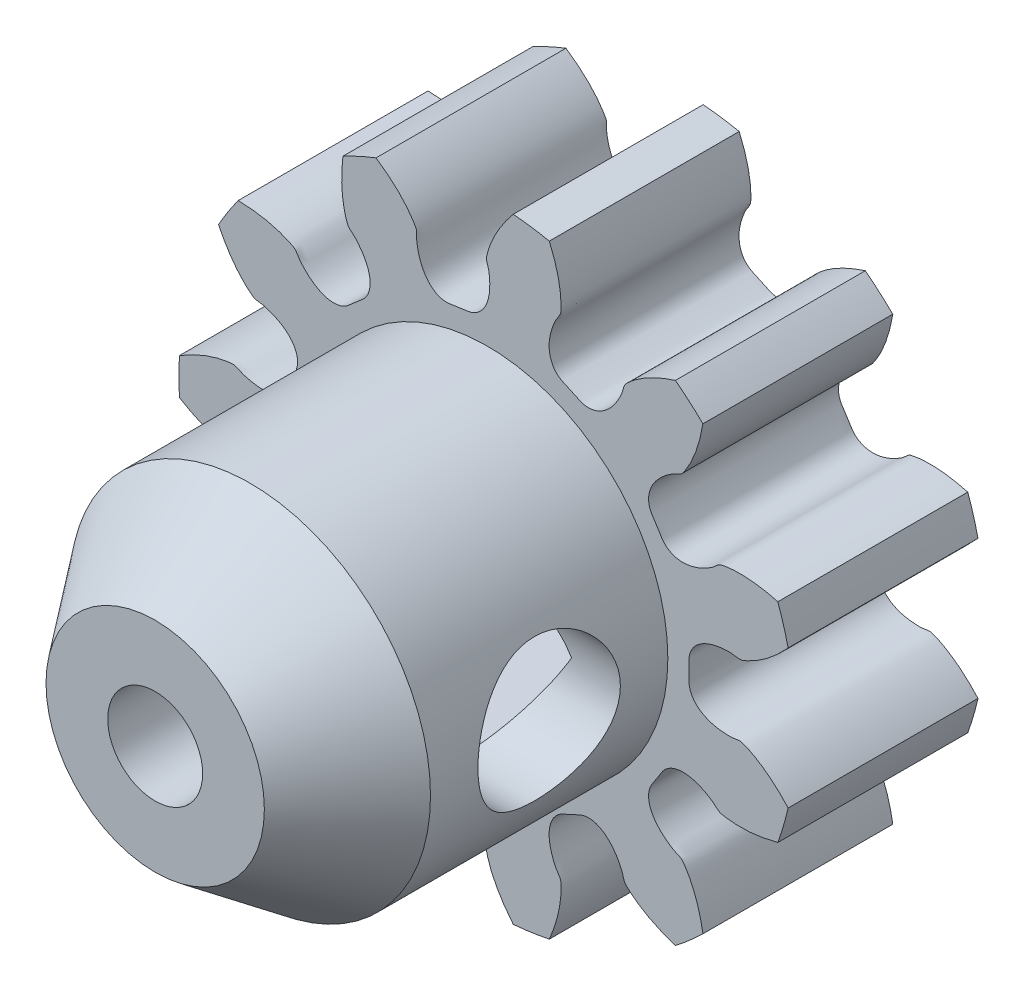
from build123d import *

# Parameters (mm, degrees)
SKETCHREVOLVESPURPINION_W       = 4
SKETCHREVOLVESPURPINION_H       = 6.499999902
TOOTHEXTRUDECUTSPURPINION_DEPTH = 2
PATTERNSPURPINION_COUNT         = 11
SKETCH1_R                       = 3.8
BOSS_EXTRUDE1_DEPTH             = 7
CHAMFER1_SIZE                   = 2
CHAMFER1_SIZE2                  = 1.5
CUT_EXTRUDE1_DEPTH              = 9
SKETCH3_R                       = 1.5
CUT_EXTRUDE2_DEPTH              = 9
SKETCH5_R                       = 1
CUT_EXTRUDE3_DEPTH              = 2


with BuildPart() as part:
    # SketchRevolveSpurPinion → SpurPinion (revolve)
    with BuildSketch(Plane(origin=(0, 0, 0), x_dir=(0, 0, -1), z_dir=(1, 0, 0))):
        with Locations((0, 3.249999951)):
            Rectangle(SKETCHREVOLVESPURPINION_W, SKETCHREVOLVESPURPINION_H)
    revolve(axis=Axis((0, 0, 0), (0, 0, -1)))

    # SketchToothSpurPinion → ToothExtrudeCutSpurPinion (cut, symmetric)
    with BuildSketch(Plane.XY):
        with BuildLine():
            ThreePointArc((6.374543401, 1.50588683), (6.549999902, 0), (6.374543401, -1.50588683))
            add(Edge.make_bspline(
                [(6.374543401, -1.50588683), (6.317672592, -1.440685446), (6.231374812, -1.348255131), (6.113043837, -1.234757319), (6.028951604, -1.159688541), (5.947483708, -1.092040478), (5.869056997, -1.031523084), (5.79407066, -0.977827594), (5.722905716, -0.93062095), (5.655922798, -0.889568861), (5.593465843, -0.854263834), (5.535846697, -0.824463365), (5.483391294, -0.799330467), (5.423302933, -0.774455108), (5.312989732, -0.72332903), (5.190756968, -0.768768581), (5.083537535, -0.766625697), (5.031278683, -0.765731508), (4.980355391, -0.762726596), (4.930720075, -0.758230258), (4.882394127, -0.752105315), (4.835376707, -0.744402623), (4.789668488, -0.735114972), (4.745265892, -0.72423865), (4.702163328, -0.711754934), (4.660353893, -0.697631874), (4.619831262, -0.681820332), (4.580592412, -0.664251063), (4.542641754, -0.644831241), (4.505997137, -0.623441187), (4.470698362, -0.599931803), (4.436818864, -0.574123801), (4.40448105, -0.545810434), (4.373875217, -0.514766276), (4.345280992, -0.480765342), (4.319086915, -0.443612262), (4.295805064, -0.403188624), (4.276057014, -0.359514565), (4.260572718, -0.312811576), (4.249988906, -0.263569949), (4.245757139, -0.218013555), (4.244894976, -0.129994862), (4.252789903, 0), (4.244894976, 0.129994862), (4.245757139, 0.218013555), (4.249988906, 0.263569949), (4.260572718, 0.312811576), (4.276057014, 0.359514565), (4.295805064, 0.403188624), (4.319086915, 0.443612262), (4.345280992, 0.480765342), (4.373875217, 0.514766276), (4.40448105, 0.545810434), (4.436818864, 0.574123801), (4.470698362, 0.599931803), (4.505997137, 0.623441187), (4.542641754, 0.644831241), (4.580592412, 0.664251063), (4.619831262, 0.681820332), (4.660353893, 0.697631874), (4.702163328, 0.711754934), (4.745265892, 0.72423865), (4.789668488, 0.735114972), (4.835376707, 0.744402623), (4.882394127, 0.752105315), (4.930720075, 0.758230258), (4.980355391, 0.762726596), (5.031278683, 0.765731508), (5.083537535, 0.766625697), (5.190756968, 0.768768581), (5.312989732, 0.72332903), (5.423302933, 0.774455108), (5.483391294, 0.799330467), (5.535846697, 0.824463365), (5.593465843, 0.854263834), (5.655922798, 0.889568861), (5.722905716, 0.93062095), (5.79407066, 0.977827594), (5.869056997, 1.031523084), (5.947483708, 1.092040478), (6.028951604, 1.159688541), (6.113043837, 1.234757319), (6.231374812, 1.348255131), (6.317672592, 1.440685446), (6.374543401, 1.50588683)],
                knots=[0, 0, 0, 0, 0.045120544, 0.065899742, 0.085491558, 0.103895991, 0.121113041, 0.137142708, 0.151984992, 0.165639894, 0.178107413, 0.18938755, 0.199480304, 0.208385675, 0.223470835, 0.261153511, 0.270450436, 0.279527598, 0.288391902, 0.297051141, 0.305514137, 0.3137909, 0.321892807, 0.329832817, 0.337625703, 0.345288317, 0.352839878, 0.360302265, 0.367700302, 0.375061988, 0.382418614, 0.389804656, 0.397257316, 0.40481549, 0.412517957, 0.420400547, 0.42849219, 0.43681006, 0.445354483, 0.454104962, 0.463018988, 0.469161013, 0.5, 0.530838987, 0.536981012, 0.545895038, 0.554645517, 0.56318994, 0.57150781, 0.579599453, 0.587482043, 0.59518451, 0.602742684, 0.610195344, 0.617581386, 0.624938012, 0.632299698, 0.639697735, 0.647160122, 0.654711683, 0.662374297, 0.670167183, 0.678107193, 0.6862091, 0.694485863, 0.702948859, 0.711608098, 0.720472402, 0.729549564, 0.738846489, 0.776529165, 0.791614325, 0.800519696, 0.81061245, 0.821892587, 0.834360106, 0.848015008, 0.862857292, 0.878886959, 0.896104009, 0.914508442, 0.934100258, 0.954879456, 1, 1, 1, 1], degree=3))
        make_face()
    toothextrudecutspurpinion = extrude(amount=TOOTHEXTRUDECUTSPURPINION_DEPTH, both=True, mode=Mode.SUBTRACT)

    # PatternSpurPinion: ToothExtrudeCutSpurPinion ×11 about axis
    patternspurpinion_axis = Axis((0, 0, 55), (0, 0, -1))
    for i in range(1, PATTERNSPURPINION_COUNT):
        add(toothextrudecutspurpinion.rotate(patternspurpinion_axis, i * 360 / PATTERNSPURPINION_COUNT), mode=Mode.SUBTRACT)

    # Sketch1 → Boss-Extrude1 (add)
    with BuildSketch(Plane.XY.offset(2)):
        Circle(SKETCH1_R)
    extrude(amount=BOSS_EXTRUDE1_DEPTH)

    # Chamfer1
    chamfer1_edges = [part.edges().sort_by_distance(p)[0] for p in [
        (-3.8, 0, 9),
    ]]
    chamfer1_side = [part.faces().sort_by_distance(p)[0] for p in [
        (-3.8, 0, 5.5),
    ]]
    chamfer(chamfer1_edges, length=CHAMFER1_SIZE, length2=CHAMFER1_SIZE2, reference=chamfer1_side[0])

    # Sketch4 → Cut-Extrude1 (cut)
    with BuildSketch(Plane(origin=(0, 0, -2), x_dir=(-1, 0, 0), z_dir=(0, 0, -1))):
        Polygon((2.771281292, 0), (1.385640646, 2.4), (-1.385640646, 2.4), (-2.771281292, 0), (-1.385640646, -2.4), (1.385640646, -2.4), align=None)
    extrude(amount=-CUT_EXTRUDE1_DEPTH, mode=Mode.SUBTRACT)

    # Sketch3 → Cut-Extrude2 (cut)
    with BuildSketch(Plane(origin=(0, 0, 0), x_dir=(0, 0, -1), z_dir=(1, 0, 0))):
        with Locations((-4.5, 0)):
            Circle(SKETCH3_R)
    extrude(amount=CUT_EXTRUDE2_DEPTH, mode=Mode.SUBTRACT)

    # Sketch5 → Cut-Extrude3 (cut)
    with BuildSketch(Plane.XY.offset(9)):
        Circle(SKETCH5_R)
    extrude(amount=-CUT_EXTRUDE3_DEPTH, mode=Mode.SUBTRACT)


solid = part.part
